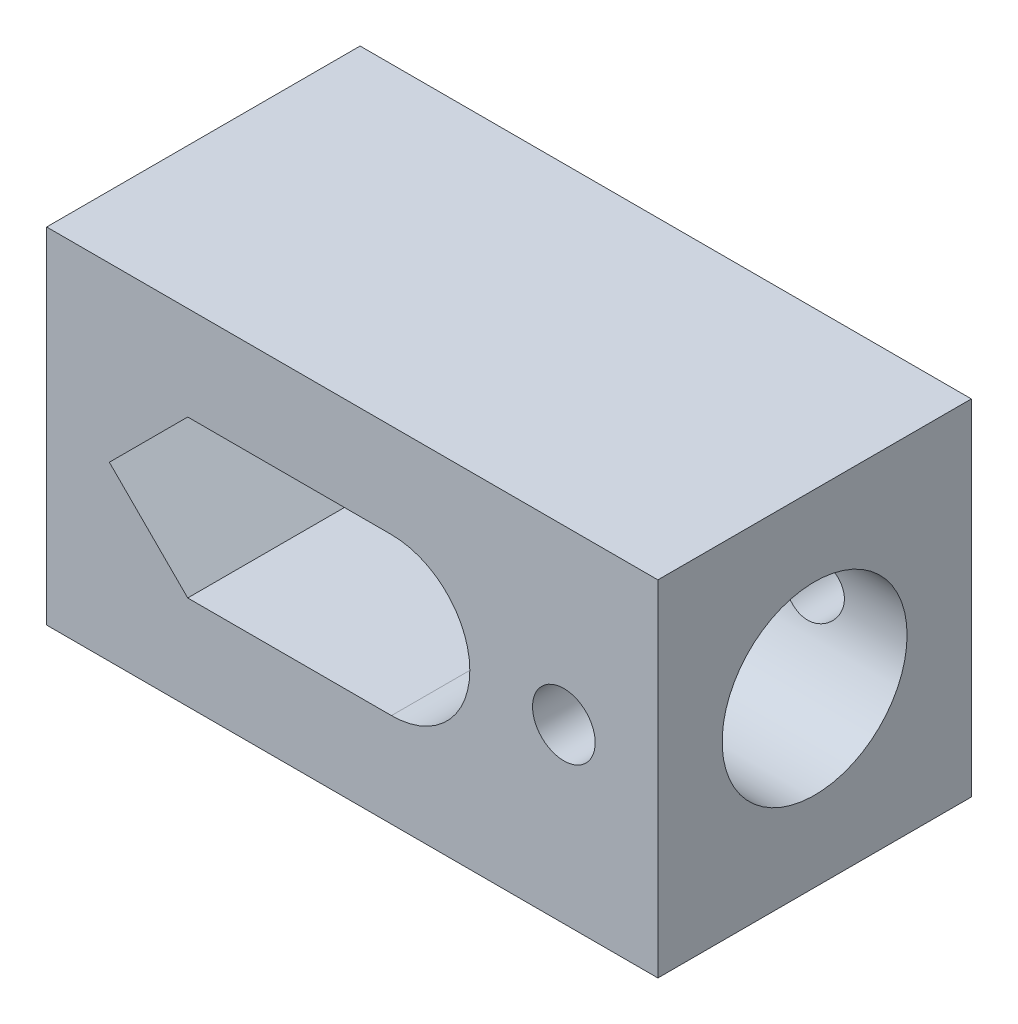
from build123d import *

# Parameters (mm, degrees)
SKETCH_1_W            = 19.5
SKETCH_1_H            = 11
EXTRUDE_1_DEPTH       = 5
SKETCH_2_R            = 2.95
CUT_EXTRUDE_1_DEPTH   = 5
HOLE_WIZARD_2_0_2_1_D = 2


with BuildPart() as part:
    # 草图1 → 凸台-拉伸1 (new, symmetric)
    with BuildSketch(Plane.XY):
        Rectangle(SKETCH_1_W, SKETCH_1_H)
        with BuildLine():
            Line((-5.25, 2.5), (-7.75, 0))
            Line((-7.75, 0), (-5.25, -2.5))
            Line((-5.25, -2.5), (1.25, -2.5))
            ThreePointArc((1.25, -2.5), (3.75, 0), (1.25, 2.5))
            Line((1.25, 2.5), (-5.25, 2.5))
        make_face(mode=Mode.SUBTRACT)
    extrude(amount=EXTRUDE_1_DEPTH, both=True)

    # 草图2 → 切除-拉伸1 (cut)
    with BuildSketch(Plane(origin=(9.75, 0, 0), x_dir=(0, 0, -1), z_dir=(1, 0, 0))):
        Circle(SKETCH_2_R)
    extrude(amount=-CUT_EXTRUDE_1_DEPTH, mode=Mode.SUBTRACT)

    # Ø2.0 (2) 直径孔1 (through all)
    with Locations(Plane.XY.offset(5)):
        with Locations((6.75, 0)):
            Hole(HOLE_WIZARD_2_0_2_1_D / 2)


solid = part.part
